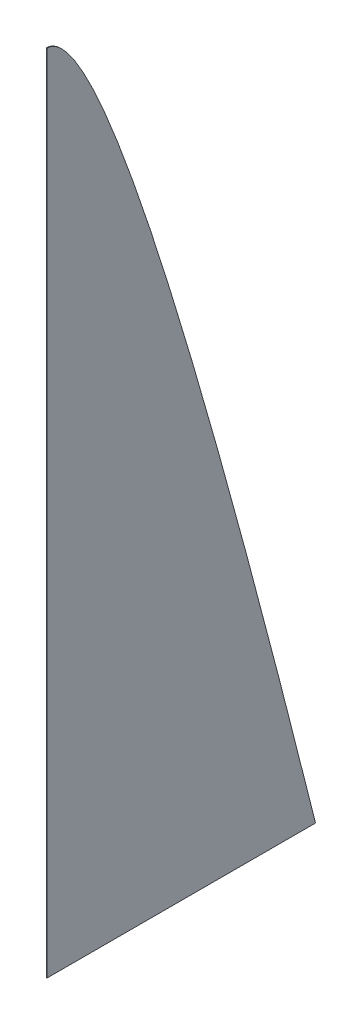
from build123d import *

# Parameters (mm, degrees)
BOSS_EXTRUDE1_DEPTH = 1


with BuildPart() as part:
    # Sketch1 → Boss-Extrude1 (new body)
    with BuildSketch(Plane(origin=(0, 0, 0), x_dir=(0, 0, -1), z_dir=(1, 0, 0))):
        with BuildLine():
            Line((0, 0), (0, 1200))
            add(Edge.make_bspline(
                [(0, 1200), (100, 1200), (400, 0)],
                knots=[0, 0, 0, 1, 1, 1], degree=2))
            Line((400, 0), (0, 0))
        make_face()
    extrude(amount=BOSS_EXTRUDE1_DEPTH)


solid = part.part
